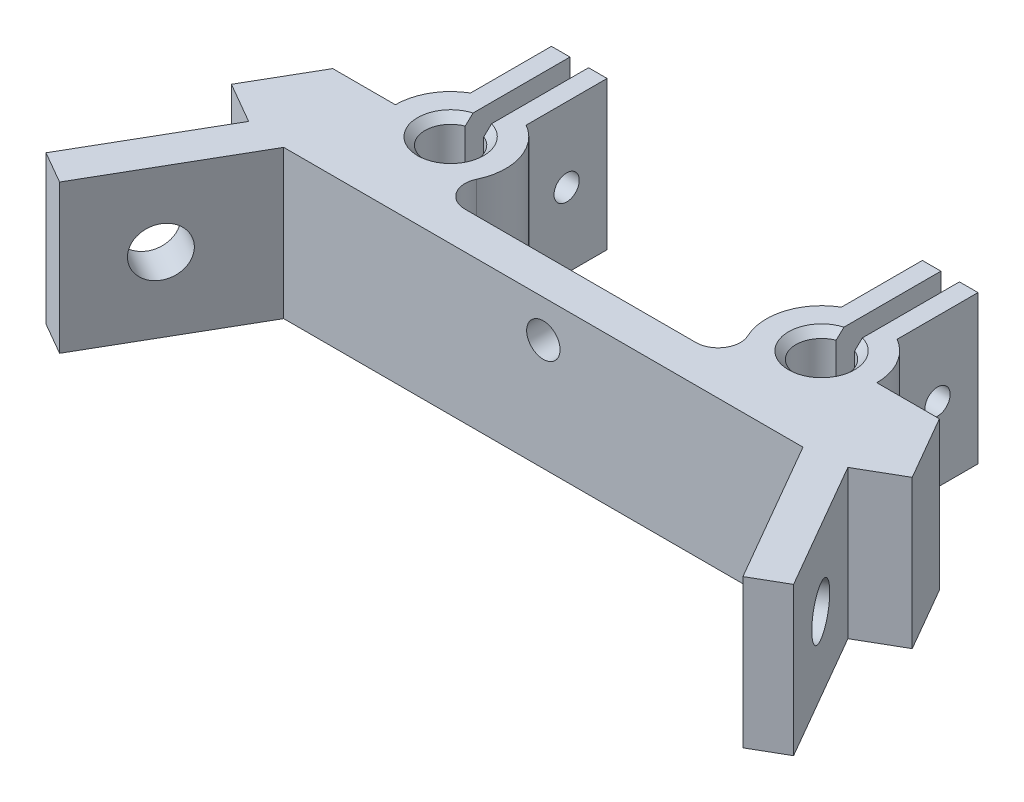
from build123d import *

# Parameters (mm, degrees)
BOSS_EXTRUDE1_DEPTH = 20
SKETCH2_R           = 1.7
CUT_EXTRUDE1_DEPTH  = 28.75
CUT_EXTRUDE2_REACH  = 63.885
SKETCH4_R           = 2.25
CHAMFER1_SIZE       = 1
CUT_EXTRUDE3_REACH  = 159.022
SKETCH5_R           = 3.3


with BuildPart() as part:
    # Sketch1 → Boss-Extrude1 (new body)
    with BuildSketch(Plane(origin=(0, 0, 0), x_dir=(1, 0, 0), z_dir=(0, 1, 0))):
        with BuildLine():
            ThreePointArc((26.25, 120.715587038), (25, 114.05), (23.75, 120.715587038))
            Line((23.75, 120.715587038), (23.75, 134.844385611))
            Line((23.75, 134.844385611), (21.25, 134.844385611))
            Line((21.25, 134.844385611), (21.25, 123.937390776))
            ThreePointArc((21.25, 123.937390776), (17.8806949, 119.694993142), (18.276133819, 114.291866029))
            ThreePointArc((18.276133819, 114.291866029), (18.105818521, 111.399312349), (15.568536699, 110))
            Line((15.568536699, 110), (-15.568536699, 110))
            ThreePointArc((-15.568536699, 110), (-18.105818521, 111.399312349), (-18.276133819, 114.291866029))
            ThreePointArc((-18.276133819, 114.291866029), (-17.8806949, 119.694993142), (-21.25, 123.937390776))
            Line((-21.25, 123.937390776), (-21.25, 134.844385611))
            Line((-21.25, 134.844385611), (-23.75, 134.844385611))
            Line((-23.75, 134.844385611), (-23.75, 120.715587038))
            ThreePointArc((-23.75, 120.715587038), (-25, 114.05), (-26.25, 120.715587038))
            Line((-26.25, 120.715587038), (-26.25, 134.844385611))
            Line((-26.25, 134.844385611), (-28.75, 134.844385611))
            Line((-28.75, 134.844385611), (-28.75, 123.937390776))
            ThreePointArc((-28.75, 123.937390776), (-31.459102105, 121.212478956), (-32.45, 117.5))
            Line((-32.45, 117.5), (-40.888972746, 117.5))
            Line((-40.888972746, 117.5), (-45.888972746, 108.839745962))
            Line((-45.888972746, 108.839745962), (-40.389711432, 105.664745962))
            Line((-40.389711432, 105.664745962), (-50.389711432, 88.344237886))
            Line((-50.389711432, 88.344237886), (-46.059584413, 85.844237886))
            Line((-46.059584413, 85.844237886), (-35, 105))
            Line((-35, 105), (35, 105))
            Line((35, 105), (46.059584413, 85.844237886))
            Line((46.059584413, 85.844237886), (50.389711432, 88.344237886))
            Line((50.389711432, 88.344237886), (40.389711432, 105.664745962))
            Line((40.389711432, 105.664745962), (45.888972746, 108.839745962))
            Line((45.888972746, 108.839745962), (40.888972746, 117.5))
            Line((40.888972746, 117.5), (32.45, 117.5))
            ThreePointArc((32.45, 117.5), (31.459102105, 121.212478956), (28.75, 123.937390776))
            Line((28.75, 123.937390776), (28.75, 134.844385611))
            Line((28.75, 134.844385611), (26.25, 134.844385611))
            Line((26.25, 134.844385611), (26.25, 120.715587038))
        make_face()
    extrude(amount=BOSS_EXTRUDE1_DEPTH)

    # Sketch2 → Cut-Extrude1 (cut, symmetric)
    with BuildSketch(Plane(origin=(0, 0, 0), x_dir=(0, 0, -1), z_dir=(1, 0, 0))):
        with Locations((129.390888193, 10)):
            Circle(SKETCH2_R)
    extrude(amount=CUT_EXTRUDE1_DEPTH, both=True, mode=Mode.SUBTRACT)

    # Sketch4 → Cut-Extrude2 (cut, up to next)
    with BuildSketch(Plane.XY.offset(-105), mode=Mode.PRIVATE) as cut_extrude2_sk1:
        with Locations((0, 15)):
            Circle(SKETCH4_R)
    cut_extrude2_tool1 = extrude(cut_extrude2_sk1.sketch, amount=-CUT_EXTRUDE2_REACH, mode=Mode.PRIVATE) & part.part
    add(cut_extrude2_tool1.solids().sort_by_distance((0, 15, -105))[0], mode=Mode.SUBTRACT)

    # Chamfer1
    chamfer1_edges = [part.edges().sort_by_distance(p)[0] for p in [
        (25, 20, -114.05),
        (-25, 20, -114.05),
    ]]
    chamfer(chamfer1_edges, length=CHAMFER1_SIZE)

    # Sketch5 → Cut-Extrude3 (cut, up to next)
    with BuildSketch(Plane(origin=(-76.046460718, 0, -43.905444566), x_dir=(-0.49999999999998673, 0, 0.8660254037844464), z_dir=(-0.8660254037844464, 0, -0.49999999999998673)), mode=Mode.PRIVATE) as cut_extrude3_sk1:
        with Locations((-61.313498572, 10)):
            Circle(SKETCH5_R)
    cut_extrude3_tool1 = extrude(cut_extrude3_sk1.sketch, amount=-CUT_EXTRUDE3_REACH, mode=Mode.PRIVATE) & part.part
    cut_extrude3 = cut_extrude3_tool1.solids().sort_by_distance((-45.389711, 10, -97.004492))[0]
    add(cut_extrude3, mode=Mode.SUBTRACT)

    # Mirror1: Cut-Extrude3 across plane
    add(cut_extrude3.mirror(Plane(origin=(0, 0, 0), x_dir=(0, 0, 1), z_dir=(1, 0, 0))), mode=Mode.SUBTRACT)


solid = part.part
